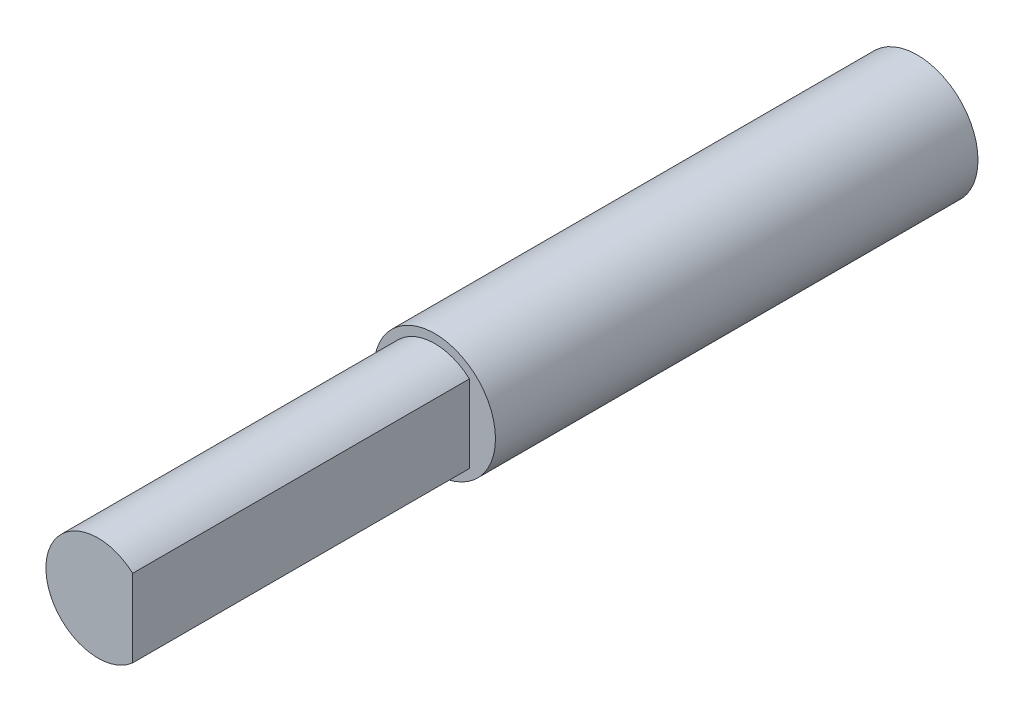
from build123d import *

# Parameters (mm, degrees)
SKETCH1_R           = 1.75
BOSS_EXTRUDE1_DEPTH = 13.9
BOSS_EXTRUDE2_DEPTH = 9.7


with BuildPart() as part:
    # Sketch1 → Boss-Extrude1 (new body)
    with BuildSketch(Plane.XY):
        Circle(SKETCH1_R)
    extrude(amount=BOSS_EXTRUDE1_DEPTH)

    # Sketch2 → Boss-Extrude2 (add)
    with BuildSketch(Plane.XY.offset(13.9)):
        with BuildLine():
            Line((1, -1.118033989), (1, 1.118033989))
            ThreePointArc((1, 1.118033989), (-1.5, 0), (1, -1.118033989))
        make_face()
    extrude(amount=BOSS_EXTRUDE2_DEPTH)


solid = part.part
